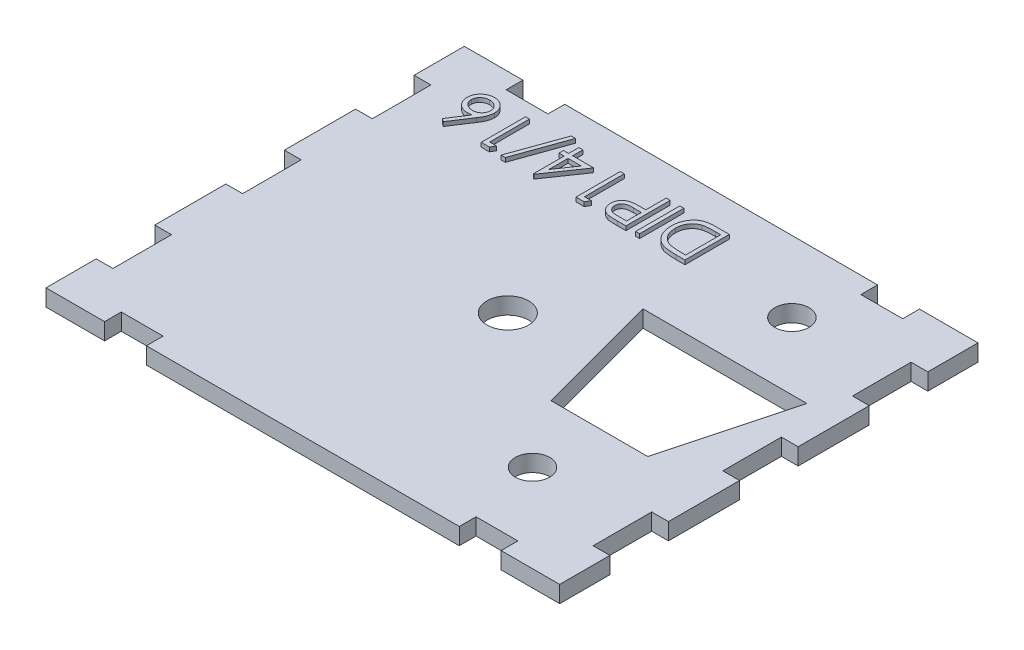
from build123d import *

# Parameters (mm, degrees)
SKETCH2_W           = 100
SKETCH2_H           = 50
BOSS_EXTRUDE1_DEPTH = 2
SKETCH12_W          = 9.8
SKETCH12_H          = 50
SKETCH12_W_2        = 8.8
CUT_EXTRUDE8_DEPTH  = 6
SKETCH13_W          = 2
SKETCH13_H          = 7
SKETCH13_W_2        = 5
SKETCH13_H_2        = 2
CUT_EXTRUDE10_DEPTH = 6
SKETCH15_W          = 6.543059906
SKETCH15_H          = 1
CUT_EXTRUDE13_DEPTH = 10
SKETCH16_R          = 2.5
CUT_EXTRUDE14_DEPTH = 10
SKETCH17_R          = 2.05
CUT_EXTRUDE15_DEPTH = 3.5
SKETCH22_W          = 0.474893162
SKETCH22_H          = 5.291666666
BOSS_EXTRUDE4_DEPTH = 0.5


with BuildPart() as part:
    # Sketch2 → Boss-Extrude1 (new body)
    with BuildSketch(Plane(origin=(0, 0, 0), x_dir=(1, 0, 0), z_dir=(0, 1, 0))):
        Rectangle(SKETCH2_W, SKETCH2_H)
    extrude(amount=BOSS_EXTRUDE1_DEPTH)

    # Sketch12 → Cut-Extrude8 (cut)
    with BuildSketch(Plane(origin=(0, 2, 0), x_dir=(1, 0, 0), z_dir=(0, 1, 0))):
        with Locations((-45.1, 0)):
            Rectangle(SKETCH12_W, SKETCH12_H)
        with Locations((45.6, 0)):
            Rectangle(SKETCH12_W_2, SKETCH12_H)
    extrude(amount=-CUT_EXTRUDE8_DEPTH, mode=Mode.SUBTRACT)

    # Sketch13 → Cut-Extrude10 (cut)
    with BuildSketch(Plane(origin=(0, 2, 0), x_dir=(1, 0, 0), z_dir=(0, 1, 0))):
        with Locations((-29.2, 0)):
            Rectangle(SKETCH13_W, SKETCH13_H)
        Polygon((-30.2, 12), (-30.2, 19), (-30.2, 25), (-40.2, 25), (-40.2, -25), (-30.2, -25), (-30.2, -19), (-30.2, -12), (-30.2, -3.5), (-30.2, 3.5), align=None)
        with Locations((-29.2, 15.5)):
            Rectangle(SKETCH13_W, SKETCH13_H)
        with Locations((21.7, -24)):
            Rectangle(SKETCH13_W_2, SKETCH13_H_2)
        with Locations((30.2, -15.5)):
            Rectangle(SKETCH13_W, SKETCH13_H)
        with Locations((30.2, 0)):
            Rectangle(SKETCH13_W, SKETCH13_H)
        with Locations((30.2, 15.5)):
            Rectangle(SKETCH13_W, SKETCH13_H)
        with Locations((21.7, 24)):
            Rectangle(SKETCH13_W_2, SKETCH13_H_2)
        with Locations((-29.2, -15.5)):
            Rectangle(SKETCH13_W, SKETCH13_H)
        Polygon((41.2, 25), (31.2, 25), (31.2, 19), (31.2, 12), (31.2, 3.5), (31.2, -3.5), (31.2, -12), (31.2, -19), (31.2, -25), (41.2, -25), align=None)
        with Locations((-20.7, 24)):
            Rectangle(SKETCH13_W_2, SKETCH13_H_2)
        with Locations((-20.7, -24)):
            Rectangle(SKETCH13_W_2, SKETCH13_H_2)
    extrude(amount=-CUT_EXTRUDE10_DEPTH, mode=Mode.SUBTRACT)

    # Sketch15 → Cut-Extrude13 (cut)
    with BuildSketch(Plane.XZ):
        Polygon((8.96933351, -7.5), (14.181143059, -7.5), (20.724202965, -7.5), (25.936012514, -7.5), (22.452673012, 5.5), (12.452673012, 5.5), align=None)
        Polygon((27.239237886, -8.5), (20.724202965, -8.5), (20.724202965, -7.5), (25.936012514, -7.5), (22.452673012, 5.5), (12.452673012, 5.5), (8.96933351, -7.5), (14.181143059, -7.5), (14.181143059, -8.5), (7.666108138, -8.5), (11.685346024, 6.5), (23.22, 6.5), align=None)
        with Locations((17.452673012, -8)):
            Rectangle(SKETCH15_W, SKETCH15_H)
    extrude(amount=-CUT_EXTRUDE13_DEPTH, mode=Mode.SUBTRACT)

    # Sketch16 → Cut-Extrude14 (cut)
    with BuildSketch(Plane(origin=(0, 0, 0), x_dir=(-1, 0, 0), z_dir=(0, -1, 0))):
        with Locations(Location((0, 0, 0), (0, 0, 90))):
            Circle(SKETCH16_R)
    extrude(amount=-CUT_EXTRUDE14_DEPTH, mode=Mode.SUBTRACT)

    # Sketch17 → Cut-Extrude15 (cut)
    with BuildSketch(Plane(origin=(0, 0, 0), x_dir=(-1, 0, 0), z_dir=(0, -1, 0))):
        with Locations(Location((-17.452672874, -14.5, 0), (0, 0, 90))):
            Circle(SKETCH17_R)
        with Locations(Location((-17.452672903, 16.5, 0), (0, 0, 90))):
            Circle(SKETCH17_R)
    extrude(amount=-CUT_EXTRUDE15_DEPTH, mode=Mode.SUBTRACT)

    # Sketch22 → Boss-Extrude4 (add)
    # profile 1 of 8: a face of its own
    with BuildSketch(Plane(origin=(0, 2, 0), x_dir=(1, 0, 0), z_dir=(0, 1, 0))):
        with BuildLine():
            Line((-23.159052189, 15.434789513), (-23.524762325, 15.722057475))
            Line((-23.524762325, 15.722057475), (-22.126583573, 17.860136735))
            add(Edge.make_bspline(
                [(-22.126583573, 17.860136735), (-22.219671968, 17.845299112), (-22.401251407, 17.816356652), (-22.585047468, 17.811582139), (-22.674618762, 17.809255325)],
                knots=[0, 0, 0, 0, 1.025318673, 2, 2, 2, 2], degree=3))
            add(Edge.make_bspline(
                [(-22.674618762, 17.809255325), (-22.728400989, 17.810700875), (-22.834269702, 17.813546396), (-22.989703794, 17.8354446), (-23.139063263, 17.869953993), (-23.281729012, 17.920258484), (-23.418213242, 17.984517961), (-23.549298709, 18.061532814), (-23.672523131, 18.15527899), (-23.789466337, 18.260002963), (-23.895659433, 18.375984455), (-23.989604348, 18.499081859), (-24.068948676, 18.629285438), (-24.132162742, 18.766565912), (-24.182681976, 18.909848669), (-24.218645522, 19.059692523), (-24.240145071, 19.216350375), (-24.243047785, 19.322909838), (-24.244522275, 19.377038778)],
                knots=[0, 0, 0, 0, 1.043709831, 2.054511743, 3.041122595, 4.01515914, 4.98481438, 5.965901842, 6.960491961, 7.985277438, 9.0096037, 10.00832444, 10.987059228, 11.962929573, 12.936966118, 13.931840027, 14.949438142, 16, 16, 16, 16], degree=3))
            add(Edge.make_bspline(
                [(-24.244522275, 19.377038778), (-24.241765926, 19.451050148), (-24.236345282, 19.596601136), (-24.196736946, 19.809434264), (-24.128885773, 20.010448656), (-24.036650034, 20.20016918), (-23.919260098, 20.374622689), (-23.778459732, 20.531757593), (-23.614944089, 20.668722639), (-23.431968854, 20.786167766), (-23.233959581, 20.879491196), (-23.026333318, 20.948483673), (-22.81087333, 20.989709211), (-22.664546047, 20.99510643), (-22.590876441, 20.997823701)],
                knots=[0, 0, 0, 0, 1.0319111, 2.029359566, 3.00642934, 3.98275322, 4.962714161, 5.929339302, 6.915525103, 7.928435063, 8.953439721, 9.960121214, 10.9730072, 12, 12, 12, 12], degree=3))
            add(Edge.make_bspline(
                [(-22.590876441, 20.997823701), (-22.519667705, 20.995519771), (-22.378615665, 20.99095609), (-22.171176785, 20.950090042), (-21.97149938, 20.884324728), (-21.782151182, 20.791819753), (-21.606444215, 20.676954008), (-21.448040764, 20.539612515), (-21.310949007, 20.379706194), (-21.196443028, 20.200218944), (-21.102738703, 20.008869195), (-21.037266108, 19.807175092), (-20.99469769, 19.599316682), (-20.990317061, 19.457808761), (-20.988112018, 19.386579043)],
                knots=[0, 0, 0, 0, 1.01206923, 2.004731945, 2.994948482, 3.995280086, 4.993424783, 5.973125358, 6.967517142, 7.97830003, 8.994392566, 9.989381197, 10.98793077, 12, 12, 12, 12], degree=3))
            add(Edge.make_bspline(
                [(-20.988112018, 19.386579043), (-20.990029791, 19.332102908), (-20.993943775, 19.220922546), (-21.017301978, 19.052049679), (-21.060143777, 18.879933588), (-21.106507967, 18.734026232), (-21.152515239, 18.613188505), (-21.19517424, 18.517766145), (-21.242872201, 18.416997068), (-21.298780854, 18.312787925), (-21.358048538, 18.202161236), (-21.427279919, 18.089213843), (-21.499523929, 17.96982056), (-21.552448048, 17.890330367), (-21.579608413, 17.849536441)],
                knots=[0, 0, 0, 0, 1.17367173, 2.395347028, 3.66355231, 4.98980831, 5.690886799, 6.447442954, 7.240630024, 8.091733897, 8.994365608, 9.943299771, 10.944512865, 12, 12, 12, 12], degree=3))
            Line((-21.579608413, 17.849536441), (-23.159052189, 15.434789513))
        make_face()
        with BuildLine():
            add(Edge.make_bspline(
                [(-22.574976001, 18.351990368), (-22.534662502, 18.353170827), (-22.455567751, 18.355486877), (-22.339738422, 18.368856378), (-22.230047885, 18.393326293), (-22.126676136, 18.427770123), (-22.028097607, 18.469851587), (-21.935878135, 18.523216081), (-21.849397085, 18.585971566), (-21.770651585, 18.658202275), (-21.698324803, 18.73607743), (-21.636116736, 18.820002143), (-21.58239629, 18.907396147), (-21.538733411, 18.999085092), (-21.50472957, 19.095009054), (-21.480133793, 19.194733457), (-21.466445311, 19.298925244), (-21.464168042, 19.369580348), (-21.463005181, 19.405659572)],
                knots=[0, 0, 0, 0, 1.129540697, 2.216149546, 3.260829642, 4.271906843, 5.264942922, 6.258225651, 7.250175744, 8.252297429, 9.247108021, 10.223125336, 11.173816288, 12.116901384, 13.062424938, 14.020354563, 14.989116641, 16, 16, 16, 16], degree=3))
            add(Edge.make_bspline(
                [(-21.463005181, 19.405659572), (-21.463988153, 19.441408485), (-21.465925219, 19.511856103), (-21.482341495, 19.615289423), (-21.508766599, 19.714507411), (-21.546331833, 19.809719363), (-21.594322411, 19.900780514), (-21.651721669, 19.988791684), (-21.721323215, 20.071410118), (-21.800392034, 20.149145715), (-21.886309432, 20.22028014), (-21.976984215, 20.283878528), (-22.072741738, 20.336666449), (-22.172562209, 20.380789653), (-22.277699679, 20.413205625), (-22.386373704, 20.438039952), (-22.500081835, 20.451613295), (-22.577063515, 20.453914999), (-22.616317147, 20.455088658)],
                knots=[0, 0, 0, 0, 0.98953633, 1.950002717, 2.892353065, 3.828177645, 4.777967117, 5.738732544, 6.732276577, 7.76327951, 8.805689376, 9.818183401, 10.825652611, 11.829169732, 12.834974292, 13.867693979, 14.912718532, 16, 16, 16, 16], degree=3))
            add(Edge.make_bspline(
                [(-22.616317147, 20.455088658), (-22.655570842, 20.45391509), (-22.732552648, 20.451613565), (-22.846259864, 20.438038923), (-22.95493727, 20.413209394), (-23.060062461, 20.380775996), (-23.159928471, 20.336717419), (-23.25576977, 20.283545779), (-23.347310327, 20.220665686), (-23.433171848, 20.149022705), (-23.512570636, 20.071851092), (-23.580572843, 19.988036472), (-23.63982321, 19.901473153), (-23.685983563, 19.809357165), (-23.723969395, 19.71456403), (-23.750265041, 19.61527397), (-23.766716316, 19.511860134), (-23.768648578, 19.441409842), (-23.769629112, 19.405659572)],
                knots=[0, 0, 0, 0, 1.087095469, 2.131941252, 3.164484274, 4.170116773, 5.173462224, 6.180759088, 7.201132453, 8.243363996, 9.274190558, 10.261329848, 11.227346438, 12.172477233, 13.108141724, 14.050330866, 15.010632948, 16, 16, 16, 16], degree=3))
            add(Edge.make_bspline(
                [(-23.769629112, 19.405659572), (-23.768806819, 19.369529093), (-23.767192925, 19.298616713), (-23.748585395, 19.19482733), (-23.723452835, 19.094198131), (-23.682836289, 18.998996027), (-23.634458761, 18.906588009), (-23.572828602, 18.819616266), (-23.502169511, 18.735612541), (-23.420333972, 18.657686085), (-23.331324788, 18.586357901), (-23.236594471, 18.523583145), (-23.137888309, 18.469996661), (-23.033811125, 18.427713104), (-22.925764521, 18.393648875), (-22.813002083, 18.369020279), (-22.695443701, 18.355466061), (-22.61564337, 18.353163689), (-22.574976001, 18.351990368)],
                knots=[0, 0, 0, 0, 0.978317929, 1.920119929, 2.851929572, 3.784133089, 4.71845084, 5.67514162, 6.667477147, 7.690549442, 8.733345855, 9.756283585, 10.767808623, 11.772962645, 12.797066014, 13.836159554, 14.89727653, 16, 16, 16, 16], degree=3))
        make_face(mode=Mode.SUBTRACT)
    # profile 2 of 8: a face of its own
    with BuildSketch(Plane(origin=(0, 2, 0), x_dir=(1, 0, 0), z_dir=(0, 1, 0))):
        Polygon((-17.770922849, 15.570473274), (-18.749329967, 15.570473274), (-18.749329967, 20.86213994), (-18.274436805, 20.86213994), (-18.274436805, 16.113208316), (-17.460334241, 16.113208316), align=None)
    # profile 3 of 8: a face of its own
    with BuildSketch(Plane(origin=(0, 2, 0), x_dir=(1, 0, 0), z_dir=(0, 1, 0))):
        Polygon((-16.239180394, 15.434789513), (-14.025839048, 21.608400624), (-13.525505181, 21.608400624), (-15.738846527, 15.434789513), align=None)
    # profile 4 of 8: a face of its own
    with BuildSketch(Plane(origin=(0, 2, 0), x_dir=(1, 0, 0), z_dir=(0, 1, 0))):
        Polygon((-12.275730541, 15.434789513), (-12.372193215, 15.434789513), (-12.372193215, 19.098251051), (-12.982770138, 19.098251051), (-12.982770138, 19.640986094), (-12.372193215, 19.640986094), (-12.372193215, 20.86213994), (-11.897300053, 20.86213994), (-11.897300053, 19.640986094), (-9.38715048, 19.640986094), align=None)
        Polygon((-11.897300053, 19.098251051), (-11.897300053, 16.800107355), (-10.319976335, 19.098251051), align=None, mode=Mode.SUBTRACT)
    # profile 5 of 8: a face of its own
    with BuildSketch(Plane(origin=(0, 2, 0), x_dir=(1, 0, 0), z_dir=(0, 1, 0))):
        Polygon((-6.441328832, 15.570473274), (-7.41973595, 15.570473274), (-7.41973595, 20.86213994), (-6.944842788, 20.86213994), (-6.944842788, 16.113208316), (-6.130740223, 16.113208316), align=None)
    # profile 6 of 8: a face of its own
    with BuildSketch(Plane(origin=(0, 2, 0), x_dir=(1, 0, 0), z_dir=(0, 1, 0))):
        with BuildLine():
            Line((-1.44965048, 15.570473274), (-2.487419243, 15.570473274))
            add(Edge.make_bspline(
                [(-2.487419243, 15.570473274), (-2.558797637, 15.570551736), (-2.69556181, 15.570702073), (-2.89167862, 15.575260081), (-3.069795714, 15.581348056), (-3.229529028, 15.589787347), (-3.371370034, 15.599760763), (-3.494676903, 15.613748966), (-3.600418851, 15.628354413), (-3.663777412, 15.643203444), (-3.692672649, 15.649975477)],
                knots=[0, 0, 0, 0, 1.415646017, 2.712440637, 3.8905458, 4.950247383, 5.884950622, 6.709939814, 7.411656543, 8, 8, 8, 8], degree=3))
            add(Edge.make_bspline(
                [(-3.692672649, 15.649975477), (-3.729250735, 15.659987537), (-3.801544991, 15.679775734), (-3.905720169, 15.719404017), (-4.004818857, 15.766413516), (-4.099255577, 15.819911156), (-4.187412521, 15.882423347), (-4.272042118, 15.950342098), (-4.351369563, 16.026414205), (-4.424197036, 16.110539513), (-4.491674835, 16.199962107), (-4.54815859, 16.296962218), (-4.598035968, 16.398174872), (-4.636905862, 16.506071206), (-4.667459093, 16.619227004), (-4.689711044, 16.737936774), (-4.704012847, 16.861944432), (-4.705369909, 16.946704527), (-4.706060736, 16.989852614)],
                knots=[0, 0, 0, 0, 0.999333726, 1.975119402, 2.933498163, 3.889020618, 4.832249799, 5.779334906, 6.747801194, 7.724875447, 8.710438469, 9.696133548, 10.679360639, 11.681339199, 12.714023775, 13.766351759, 14.862936069, 16, 16, 16, 16], degree=3))
            add(Edge.make_bspline(
                [(-4.706060736, 16.989852614), (-4.705423582, 17.033361872), (-4.704176947, 17.118490673), (-4.689214706, 17.243030484), (-4.669060726, 17.362045193), (-4.638071135, 17.475270909), (-4.597483034, 17.582035229), (-4.54987005, 17.683969711), (-4.492442569, 17.779340167), (-4.426455743, 17.868492833), (-4.353050356, 17.951511391), (-4.272536986, 18.027794235), (-4.185240674, 18.096894842), (-4.091438855, 18.158968123), (-3.99021706, 18.212574641), (-3.883110471, 18.260588662), (-3.76918812, 18.300912765), (-3.690353604, 18.322124882), (-3.650271473, 18.332909839)],
                knots=[0, 0, 0, 0, 1.121902311, 2.195077645, 3.232258892, 4.234102512, 5.217864754, 6.176164875, 7.132989551, 8.084763148, 9.034132444, 9.988522005, 10.94243251, 11.903244335, 12.886203696, 13.894208494, 14.929344452, 16, 16, 16, 16], degree=3))
            add(Edge.make_bspline(
                [(-3.650271473, 18.332909839), (-3.617119055, 18.339954568), (-3.544463603, 18.355393501), (-3.424814847, 18.37274643), (-3.285437454, 18.386977728), (-3.126805647, 18.400258489), (-2.948549501, 18.407295632), (-2.751077849, 18.415558386), (-2.533722382, 18.419457128), (-2.38212372, 18.419703577), (-2.302974131, 18.419832248)],
                knots=[0, 0, 0, 0, 0.601372724, 1.317943291, 2.144091499, 3.08771165, 4.142394186, 5.309582461, 6.595334295, 8, 8, 8, 8], degree=3))
            Line((-2.302974131, 18.419832248), (-1.924543642, 18.419832248))
            Line((-1.924543642, 18.419832248), (-1.924543642, 20.86213994))
            Line((-1.924543642, 20.86213994), (-1.44965048, 20.86213994))
            Line((-1.44965048, 20.86213994), (-1.44965048, 15.570473274))
        make_face()
        with BuildLine():
            Line((-1.924543642, 16.113208316), (-1.924543642, 17.877097205))
            Line((-1.924543642, 17.877097205), (-2.851009321, 17.888757528))
            add(Edge.make_bspline(
                [(-2.851009321, 17.888757528), (-2.89624616, 17.888787356), (-2.983574947, 17.888844938), (-3.110064678, 17.88271634), (-3.227135441, 17.876049117), (-3.334960087, 17.865266634), (-3.433046475, 17.852115365), (-3.521632085, 17.834532053), (-3.601423874, 17.81659821), (-3.693335177, 17.785479811), (-3.796285476, 17.738533756), (-3.90802301, 17.66841397), (-4.003493568, 17.580080672), (-4.085411894, 17.479688961), (-4.150162735, 17.367889769), (-4.197090477, 17.248603261), (-4.225734196, 17.122282387), (-4.229334469, 17.03593638), (-4.231167574, 16.991972673)],
                knots=[0, 0, 0, 0, 1.160501667, 2.240324542, 3.248665471, 4.168823117, 5.020172044, 5.786515869, 6.485785279, 7.116517804, 8.272762037, 9.381837012, 10.485674779, 11.594342068, 12.695271952, 13.786226926, 14.872841088, 16, 16, 16, 16], degree=3))
            add(Edge.make_bspline(
                [(-4.231167574, 16.991972673), (-4.229252686, 16.949433268), (-4.225446127, 16.864870196), (-4.197327084, 16.740876728), (-4.149665756, 16.622946321), (-4.085359106, 16.512033242), (-4.005403832, 16.411908358), (-3.911831984, 16.325543685), (-3.806099397, 16.255641595), (-3.708512613, 16.209108439), (-3.621180127, 16.181820361), (-3.545689136, 16.16211975), (-3.460018409, 16.148532658), (-3.364978711, 16.135532366), (-3.260691725, 16.125038301), (-3.146494313, 16.117750887), (-3.022766861, 16.113530682), (-2.936875091, 16.113318373), (-2.892350467, 16.113208316)],
                knots=[0, 0, 0, 0, 1.12039168, 2.227199994, 3.330242575, 4.460839274, 5.593542475, 6.693949254, 7.801736126, 8.92216649, 9.528704869, 10.210659466, 10.975987387, 11.81211542, 12.738540127, 13.736887663, 14.826846554, 16, 16, 16, 16], degree=3))
            Line((-2.892350467, 16.113208316), (-1.924543642, 16.113208316))
        make_face(mode=Mode.SUBTRACT)
    # profile 7 of 8: a face of its own
    with BuildSketch(Plane(origin=(0, 2, 0), x_dir=(1, 0, 0), z_dir=(0, 1, 0))):
        with Locations((-0.058891933, 18.216306607)):
            Rectangle(SKETCH22_W, SKETCH22_H)
    # profile 8 of 8: a face of its own
    with BuildSketch(Plane(origin=(0, 2, 0), x_dir=(1, 0, 0), z_dir=(0, 1, 0))):
        with BuildLine():
            Line((5.605905076, 20.86213994), (5.605905076, 15.570473274))
            Line((5.605905076, 15.570473274), (4.53739546, 15.570473274))
            add(Edge.make_bspline(
                [(4.53739546, 15.570473274), (4.444460011, 15.571140574), (4.264909207, 15.572429795), (4.005450118, 15.580650845), (3.765726594, 15.595047052), (3.54587477, 15.616421321), (3.345541437, 15.642076434), (3.165047451, 15.674703333), (3.004100309, 15.713074776), (2.905116944, 15.745802175), (2.858308922, 15.761278562)],
                knots=[0, 0, 0, 0, 1.314317071, 2.539253741, 3.67075822, 4.709970291, 5.662644612, 6.526156501, 7.303037452, 8, 8, 8, 8], degree=3))
            add(Edge.make_bspline(
                [(2.858308922, 15.761278562), (2.797079258, 15.78460108), (2.676008415, 15.830717239), (2.503719985, 15.917841975), (2.340979611, 16.01615447), (2.189072297, 16.127908689), (2.047663322, 16.251676544), (1.914973455, 16.386456655), (1.794806005, 16.535847196), (1.68301636, 16.695212634), (1.585171417, 16.866003227), (1.49889098, 17.044798063), (1.425220585, 17.231250227), (1.36773789, 17.426720174), (1.320247249, 17.629330494), (1.288382194, 17.840615192), (1.267215519, 18.059342464), (1.265098763, 18.207774813), (1.264024734, 18.283088458)],
                knots=[0, 0, 0, 0, 0.984696416, 1.947063185, 2.89840987, 3.841051395, 4.778753227, 5.721858861, 6.681155121, 7.65838316, 8.646299769, 9.637283673, 10.641736726, 11.657050558, 12.698485921, 13.768600492, 14.86780186, 16, 16, 16, 16], degree=3))
            add(Edge.make_bspline(
                [(1.264024734, 18.283088458), (1.264976314, 18.348495109), (1.266851503, 18.477385745), (1.283668786, 18.667345988), (1.308159397, 18.851656097), (1.345902145, 19.029506784), (1.392279559, 19.202095469), (1.449521112, 19.368604968), (1.517366886, 19.529148452), (1.596048715, 19.682450768), (1.682202107, 19.828139144), (1.776080372, 19.963905237), (1.874469176, 20.091245929), (1.980956938, 20.207284453), (2.092017956, 20.315634282), (2.21142957, 20.411489008), (2.335452861, 20.499298667), (2.467813849, 20.57639663), (2.609598505, 20.644977559), (2.764510447, 20.702894566), (2.93198429, 20.752736464), (3.113129749, 20.792447078), (3.307342686, 20.824455847), (3.51514957, 20.845772044), (3.736161267, 20.860227086), (3.887925655, 20.861489941), (3.966039624, 20.86213994)],
                knots=[0, 0, 0, 0, 1.105894396, 2.179280415, 3.222964075, 4.248423888, 5.251546139, 6.243661943, 7.223682738, 8.196462441, 9.155694589, 10.083899862, 10.986397372, 11.874737962, 12.745335529, 13.607670254, 14.461432187, 15.313100333, 16.195087267, 17.121790994, 18.106827133, 19.14775296, 20.255889161, 21.433815148, 22.679170477, 24, 24, 24, 24], degree=3))
            Line((3.966039624, 20.86213994), (5.605905076, 20.86213994))
        make_face()
        with BuildLine():
            Line((5.131011913, 20.319404897), (4.523615078, 20.319404897))
            add(Edge.make_bspline(
                [(4.523615078, 20.319404897), (4.43633528, 20.319029799), (4.268464263, 20.318308348), (4.027076577, 20.311977696), (3.806520823, 20.301633338), (3.606765683, 20.287156732), (3.427923944, 20.268002993), (3.269621846, 20.246647485), (3.132378301, 20.220041815), (3.049330224, 20.195925484), (3.010953153, 20.184781166)],
                knots=[0, 0, 0, 0, 1.375205317, 2.645023457, 3.804390687, 4.853969522, 5.800190428, 6.637939096, 7.370582563, 8, 8, 8, 8], degree=3))
            add(Edge.make_bspline(
                [(3.010953153, 20.184781166), (2.962649245, 20.167771153), (2.867195169, 20.134157409), (2.729806465, 20.07281971), (2.601607188, 20.000252482), (2.480460122, 19.919112184), (2.367143839, 19.828145931), (2.262183099, 19.72706443), (2.16474884, 19.617037922), (2.076401079, 19.49769567), (1.996497537, 19.370361835), (1.927461141, 19.235178257), (1.86926424, 19.092903538), (1.821517552, 18.944032676), (1.784291508, 18.788477067), (1.758082908, 18.625846346), (1.741841746, 18.456204737), (1.739903139, 18.340720228), (1.738917896, 18.282028428)],
                knots=[0, 0, 0, 0, 0.998420628, 1.972994, 2.929372424, 3.86770908, 4.81360496, 5.759023883, 6.706048443, 7.676227424, 8.651287839, 9.634325482, 10.632389399, 11.645655052, 12.680158286, 13.74837235, 14.855672678, 16, 16, 16, 16], degree=3))
            add(Edge.make_bspline(
                [(1.738917896, 18.282028428), (1.739694765, 18.220141275), (1.74122093, 18.098563415), (1.760371555, 17.920167468), (1.788416869, 17.748614566), (1.828757867, 17.583781197), (1.880874956, 17.425881815), (1.943237279, 17.274024356), (2.018954927, 17.130163079), (2.104675311, 16.993079534), (2.20091214, 16.864849767), (2.307238512, 16.746976056), (2.422533281, 16.639238831), (2.546265088, 16.541466557), (2.680163913, 16.455397979), (2.821963925, 16.378832716), (2.973662565, 16.313778315), (3.0792147, 16.279190191), (3.132856531, 16.261612429)],
                knots=[0, 0, 0, 0, 1.122272916, 2.204715076, 3.251197285, 4.274229216, 5.279697671, 6.265416158, 7.248880903, 8.225321784, 9.195852973, 10.153576302, 11.101466393, 12.055578741, 13.010401466, 13.985536859, 14.976245305, 16, 16, 16, 16], degree=3))
            add(Edge.make_bspline(
                [(3.132856531, 16.261612429), (3.177232669, 16.249341164), (3.271588514, 16.223249085), (3.425560085, 16.194786915), (3.598847275, 16.169682494), (3.792219442, 16.148428077), (4.00545616, 16.133177008), (4.238721426, 16.121729901), (4.492116067, 16.114009159), (4.667772993, 16.113481947), (4.758941601, 16.113208316)],
                knots=[0, 0, 0, 0, 0.674548936, 1.434276114, 2.292660221, 3.240891867, 4.284742987, 5.42552168, 6.663806718, 8, 8, 8, 8], degree=3))
            Line((4.758941601, 16.113208316), (5.131011913, 16.113208316))
            Line((5.131011913, 16.113208316), (5.131011913, 20.319404897))
        make_face(mode=Mode.SUBTRACT)
    extrude(amount=BOSS_EXTRUDE4_DEPTH)


solid = part.part
